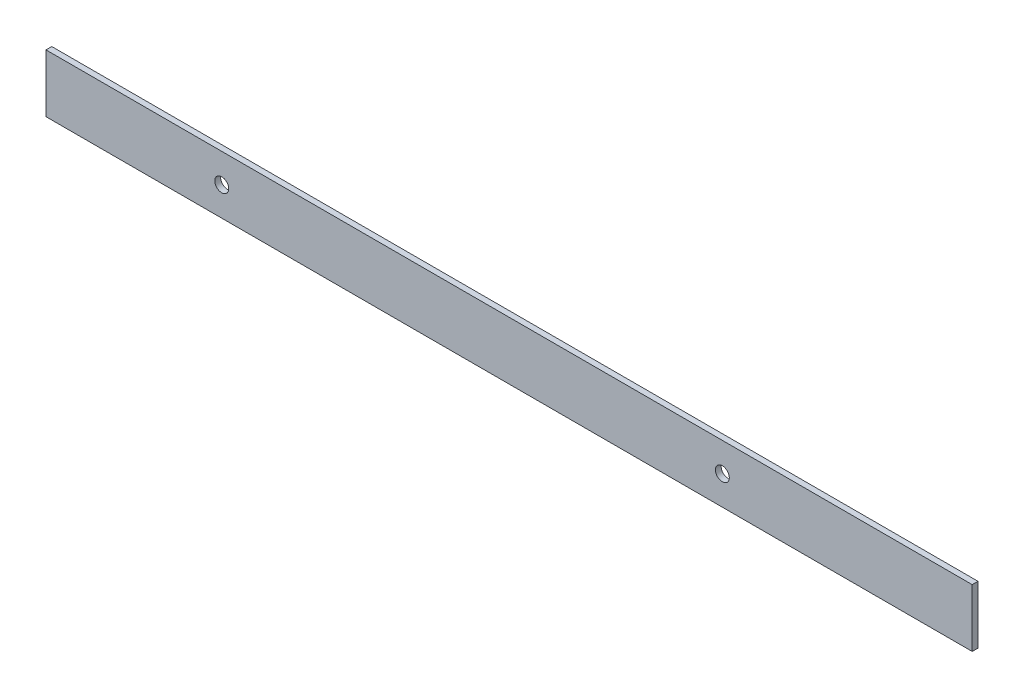
from build123d import *

# Parameters (mm, degrees)
SZKIC1_W                    = 400
SZKIC1_H                    = 50
SZKIC1_R                    = 6
DODANIE_WYCI_GNI_CIE1_DEPTH = 5


with BuildPart() as part:
    # Szkic1 → Dodanie-wyciągnięcie1 (new body)
    # profile 1 of 2: a face of its own
    with BuildSketch(Plane.XY):
        with Locations((200, 25)):
            Rectangle(SZKIC1_W, SZKIC1_H)
        with Locations((151.798792626, 25.002680082)):
            Circle(SZKIC1_R, mode=Mode.SUBTRACT)
    # profile 2 of 2: a face of its own
    with BuildSketch(Plane.XY):
        with Locations((600, 25)):
            Rectangle(SZKIC1_W, SZKIC1_H)
        with Locations((584.176275294, 25.002680082)):
            Circle(SZKIC1_R, mode=Mode.SUBTRACT)
    extrude(amount=DODANIE_WYCI_GNI_CIE1_DEPTH)


solid = part.part
